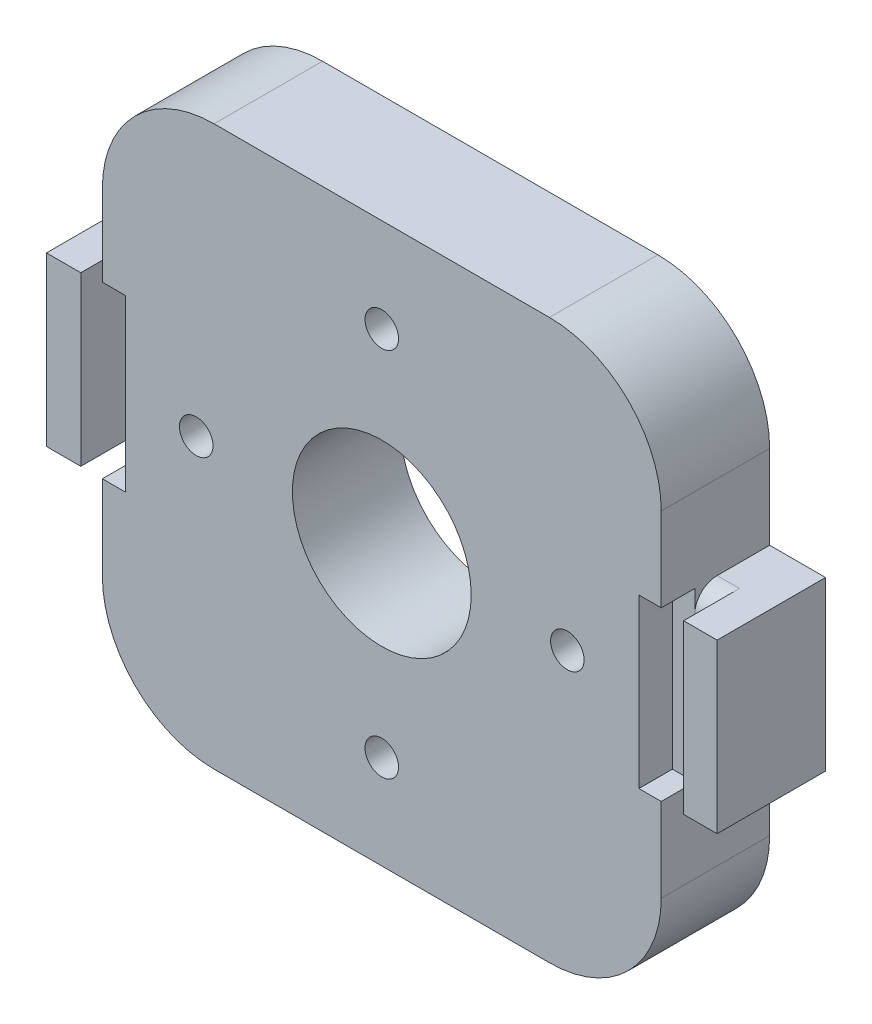
from build123d import *

# Parameters (mm, degrees)
SKETCH1_W           = 50
SKETCH1_H           = 50
SKETCH1_R           = 8
SKETCH1_R_2         = 1.5
BOSS_EXTRUDE1_DEPTH = 9.7
FILLET2_R           = 10
CUT_EXTRUDE1_DEPTH  = 2.5
SKETCH7_W           = 9.7
SKETCH7_H           = 15
BOSS_EXTRUDE2_DEPTH = 5
SKETCH10_W          = 4
SKETCH10_H          = 15
CUT_EXTRUDE2_DEPTH  = 3
FILLET3_R           = 2
CIRPATTERN9_COUNT   = 2
SKETCH11_W          = 4
SKETCH11_H          = 15.220357073
CUT_EXTRUDE3_DEPTH  = 4
FILLET5_R           = 2


with BuildPart() as part:
    # Sketch1 → Boss-Extrude1 (new body)
    with BuildSketch(Plane.XY):
        Rectangle(SKETCH1_W, SKETCH1_H)
        Circle(SKETCH1_R, mode=Mode.SUBTRACT)
        with Locations((16.6, 0)):
            Circle(SKETCH1_R_2, mode=Mode.SUBTRACT)
        with Locations((0, -16.6)):
            Circle(SKETCH1_R_2, mode=Mode.SUBTRACT)
        with Locations((-16.6, 0)):
            Circle(SKETCH1_R_2, mode=Mode.SUBTRACT)
        with Locations((0, 16.6)):
            Circle(SKETCH1_R_2, mode=Mode.SUBTRACT)
    extrude(amount=BOSS_EXTRUDE1_DEPTH)

    # Fillet2
    fillet2_edges = [part.edges().sort_by_distance(p)[0] for p in [
        (-25, -25, 4.85),
        (-25, 25, 4.85),
        (25, 25, 4.85),
        (25, -25, 4.85),
    ]]
    fillet(fillet2_edges, radius=FILLET2_R)

    # Sketch9 → Cut-Extrude1 (cut)
    with BuildSketch(Plane(origin=(0, 0, 0), x_dir=(-1, 0, 0), z_dir=(0, 0, -1))):
        Polygon((2.996447897, -15.020262794), (2.996447897, -18.370262794), (0.095262794, -20.045262794), (-2.805922308, -18.370262794), (-2.805922308, -15.020262794), (0.095262794, -13.345262794), align=None)
        Polygon((18.275, -2.901185103), (14.925, -2.901185103), (13.25, 0), (14.925, 2.901185103), (18.275, 2.901185103), (19.95, 0), align=None)
        Polygon((2.805922308, 14.829737206), (-0.095262794, 13.154737206), (-2.996447897, 14.829737206), (-2.996447897, 18.179737206), (-0.095262794, 19.854737206), (2.805922308, 18.179737206), align=None)
        Polygon((-13.25, -0.190525589), (-14.925, -3.091710692), (-18.275, -3.091710692), (-19.95, -0.190525589), (-18.275, 2.710659514), (-14.925, 2.710659514), align=None)
    extrude(amount=-CUT_EXTRUDE1_DEPTH, mode=Mode.SUBTRACT)

    # Sketch7 → Boss-Extrude2 (add)
    with BuildSketch(Plane(origin=(25, 0, 0), x_dir=(0, 0, -1), z_dir=(1, 0, 0))):
        with Locations((-4.85, 0)):
            Rectangle(SKETCH7_W, SKETCH7_H)
    boss_extrude2 = extrude(amount=BOSS_EXTRUDE2_DEPTH)

    # Sketch10 → Cut-Extrude2 (cut)
    with BuildSketch(Plane.XY.offset(9.7)):
        with Locations((25, 0)):
            Rectangle(SKETCH10_W, SKETCH10_H)
        Polygon((-26.926788745, 7.758740095), (-27.070725077, -7.2405693), (-23.070909239, -7.278952322), (-22.926972907, 7.720357073), align=None)
    extrude(amount=-CUT_EXTRUDE2_DEPTH, mode=Mode.SUBTRACT)

    # Fillet3
    fillet3_edges = [part.edges().sort_by_distance(p)[0] for p in [
        (26, -7.5, 6.7),
        (26, 7.5, 6.7),
    ]]
    fillet(fillet3_edges, radius=FILLET3_R)

    # CirPattern9: Boss-Extrude2 ×2 about axis
    cirpattern9_axis = Axis((0, 0, 0), (0, 0, 1))
    for i in range(1, CIRPATTERN9_COUNT):
        add(boss_extrude2.rotate(cirpattern9_axis, i * 360 / CIRPATTERN9_COUNT))

    # Sketch11 → Cut-Extrude3 (cut)
    with BuildSketch(Plane.XY.offset(9.7)):
        with Locations((-24.926972907, 0.110178536)):
            Rectangle(SKETCH11_W, SKETCH11_H)
    extrude(amount=-CUT_EXTRUDE3_DEPTH, mode=Mode.SUBTRACT)

    # Fillet5
    fillet5_edges = [part.edges().sort_by_distance(p)[0] for p in [
        (-25.963486453, -7.5, 5.7),
        (-25.963486453, 7.5, 5.7),
    ]]
    fillet(fillet5_edges, radius=FILLET5_R)


solid = part.part
